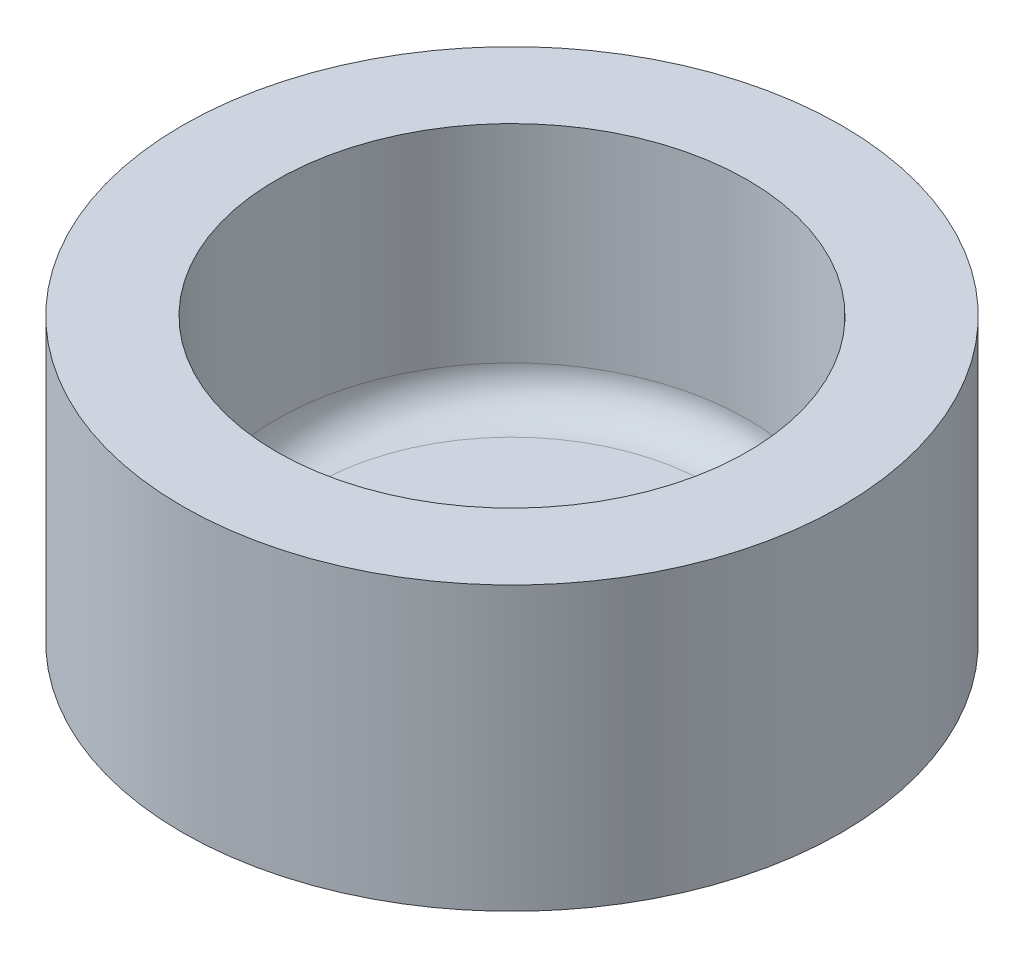
from build123d import *

# Parameters (mm, degrees)
SKETCH1_R           = 17.5
SKETCH1_R_2         = 12.5
BOSS_EXTRUDE1_DEPTH = 15
SKETCH2_R           = 12.5
BOSS_EXTRUDE2_DEPTH = 2
FILLET1_R           = 2


with BuildPart() as part:
    # Sketch1 → Boss-Extrude1 (new body)
    with BuildSketch(Plane(origin=(0, 0, 0), x_dir=(1, 0, 0), z_dir=(0, 1, 0))):
        with Locations(Location((0, 0, 0), (0, 0, 270))):
            Circle(SKETCH1_R)
        with Locations(Location((0, 0, 0), (0, 0, 270))):
            Circle(SKETCH1_R_2, mode=Mode.SUBTRACT)
    extrude(amount=BOSS_EXTRUDE1_DEPTH)

    # Sketch2 → Boss-Extrude2 (add)
    with BuildSketch(Plane.XZ):
        with Locations(Location((0, 0, 0), (0, 0, 270))):
            Circle(SKETCH2_R)
    extrude(amount=-BOSS_EXTRUDE2_DEPTH)

    # Fillet1
    fillet1_edges = [part.edges().sort_by_distance(p)[0] for p in [
        (0, 2, -12.5),
    ]]
    fillet(fillet1_edges, radius=FILLET1_R)


solid = part.part
